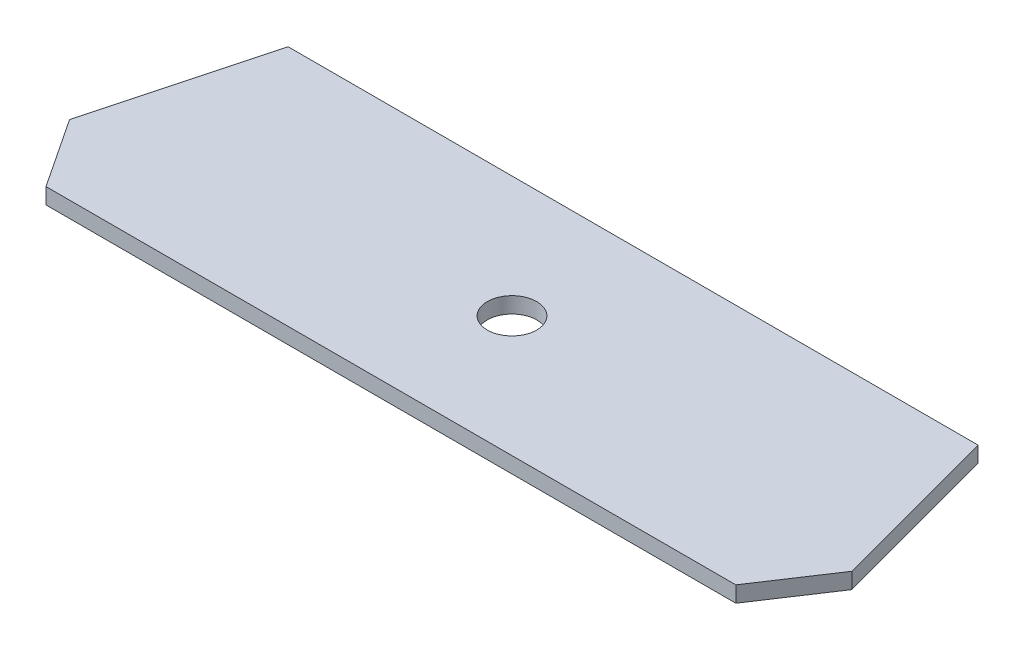
from build123d import *

# Parameters (mm, degrees)
BOSS_EXTRUDE1_DEPTH = 2.54
SKETCH2_R           = 3.937
CUT_EXTRUDE4_DEPTH  = 2.54


with BuildPart() as part:
    # Sketch1 → Boss-Extrude1 (new body)
    with BuildSketch(Plane(origin=(0, 0, 0), x_dir=(1, 0, 0), z_dir=(0, 1, 0))):
        Polygon((-54.991, 19.304), (-62.357, -8.186286249), (-54.991, -19.304), (54.991, -19.304), (62.357, -8.186286249), (54.991, 19.304), align=None)
    extrude(amount=BOSS_EXTRUDE1_DEPTH)

    # Sketch2 → Cut-Extrude4 (cut)
    with BuildSketch(Plane(origin=(0, 2.54, 0), x_dir=(1, 0, 0), z_dir=(0, 1, 0))):
        with Locations(Location((0, 0, 0), (0, 0, 270))):
            Circle(SKETCH2_R)
    extrude(amount=-CUT_EXTRUDE4_DEPTH, mode=Mode.SUBTRACT)


solid = part.part
